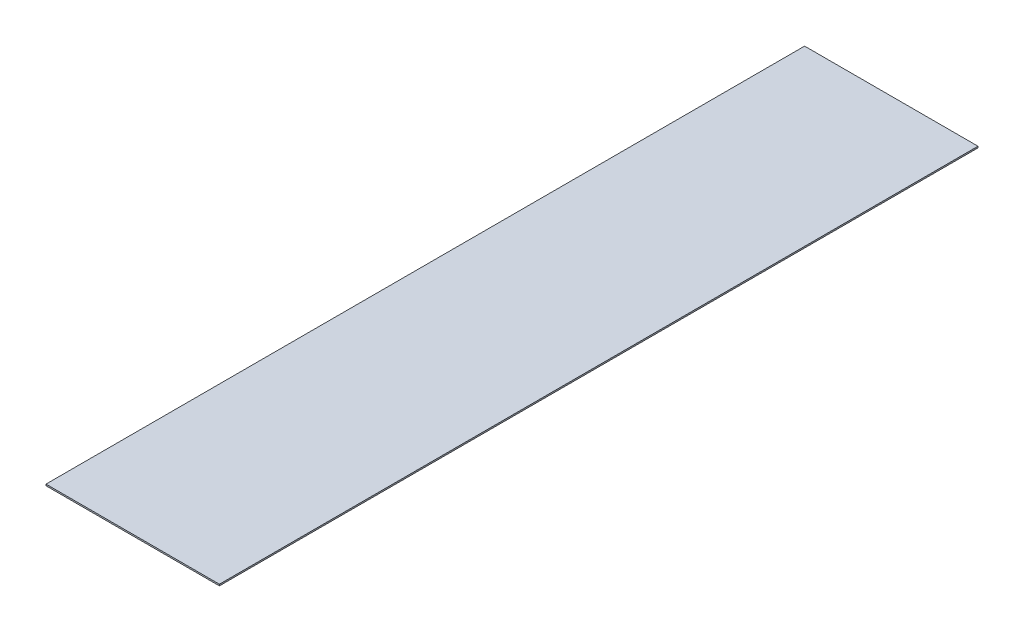
from build123d import *

# Parameters (mm, degrees)
CROQUIS1_W              = 400
CROQUIS1_H              = 1750
SALIENTE_EXTRUIR1_DEPTH = 3.4163


with BuildPart() as part:
    # Croquis1 → Saliente-Extruir1 (new body)
    with BuildSketch(Plane(origin=(0, 0, 0), x_dir=(1, 0, 0), z_dir=(0, 1, 0))):
        with Locations((200, 875)):
            Rectangle(CROQUIS1_W, CROQUIS1_H)
    extrude(amount=SALIENTE_EXTRUIR1_DEPTH)


solid = part.part
